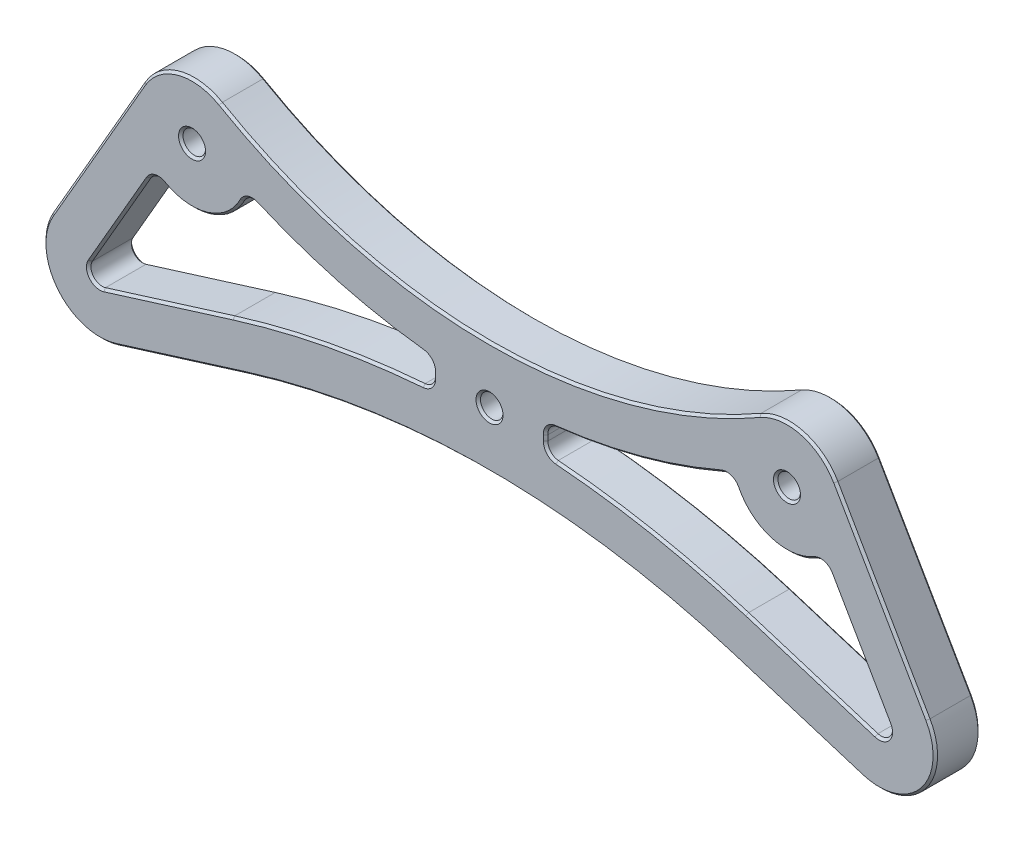
from build123d import *

# Parameters (mm, degrees)
SKETCH1_R           = 2
BOSS_EXTRUDE1_DEPTH = 8
CHAMFER1_SIZE       = 0.4


with BuildPart() as part:
    # Sketch1 → Boss-Extrude1 (new body)
    with BuildSketch(Plane.XY):
        with BuildLine():
            Line((-66.308814514, -129.547773352), (-43.320112037, -122.388992281))
            ThreePointArc((-43.320112037, -122.388992281), (0, -115.8), (43.320112037, -122.388992281))
            Line((43.320112037, -122.388992281), (66.308814514, -129.547773352))
            ThreePointArc((66.308814514, -129.547773352), (77.091963333, -126.245396489), (77.942286341, -115))
            Line((77.942286341, -115), (61.560254038, -86.62548772))
            ThreePointArc((61.560254038, -86.62548772), (55.488190451, -81.966229458), (47.9, -82.965233683))
            ThreePointArc((47.9, -82.965233683), (0, -95.8), (-47.9, -82.965233683))
            ThreePointArc((-47.9, -82.965233683), (-55.488190451, -81.966229458), (-61.560254038, -86.62548772))
            Line((-61.560254038, -86.62548772), (-77.942286341, -115))
            ThreePointArc((-77.942286341, -115), (-77.091963333, -126.245396489), (-66.308814514, -129.547773352))
        make_face()
        with Locations((-52.9, -91.62548772)):
            Circle(SKETCH1_R, mode=Mode.SUBTRACT)
        with Locations((0, -105.8)):
            Circle(SKETCH1_R, mode=Mode.SUBTRACT)
        with Locations((52.9, -91.62548772)):
            Circle(SKETCH1_R, mode=Mode.SUBTRACT)
        with BuildLine():
            Line((-71.01408311, -119), (-60.632050808, -101.017792566))
            ThreePointArc((-60.632050808, -101.017792566), (-59.41763809, -100.085940913), (-57.9, -100.285741758))
            ThreePointArc((-57.9, -100.285741758), (-50.03884881, -101.207440229), (-43.970129475, -96.126311247))
            ThreePointArc((-43.970129475, -96.126311247), (-42.86414468, -95.145621216), (-41.386723322, -95.192327068))
            ThreePointArc((-41.386723322, -95.192327068), (-26.865416882, -100.263100769), (-11.754209758, -103.132335147))
            ThreePointArc((-11.754209758, -103.132335147), (-10.451372404, -103.830597372), (-9.98390649, -105.23289225))
            ThreePointArc((-9.98390649, -105.23289225), (-9.999586121, -105.709019747), (-9.992572367, -106.185353717))
            ThreePointArc((-9.992572367, -106.185353717), (-10.497515805, -107.592554365), (-11.837059844, -108.256484561))
            ThreePointArc((-11.837059844, -108.256484561), (-28.950552114, -110.551129126), (-45.698686268, -114.750773599))
            Line((-45.698686268, -114.750773599), (-68.687388745, -121.90955467))
            ThreePointArc((-68.687388745, -121.90955467), (-70.844018509, -121.249079298), (-71.01408311, -119))
        make_face(mode=Mode.SUBTRACT)
        with BuildLine():
            Line((71.01408311, -119), (60.632050808, -101.017792566))
            ThreePointArc((60.632050808, -101.017792566), (59.41763809, -100.085940913), (57.9, -100.285741758))
            ThreePointArc((57.9, -100.285741758), (50.03884881, -101.207440229), (43.970129475, -96.126311247))
            ThreePointArc((43.970129475, -96.126311247), (42.86414468, -95.145621216), (41.386723322, -95.192327068))
            ThreePointArc((41.386723322, -95.192327068), (26.865416882, -100.263100769), (11.754209758, -103.132335147))
            ThreePointArc((11.754209758, -103.132335147), (10.451372404, -103.830597372), (9.98390649, -105.23289225))
            ThreePointArc((9.98390649, -105.23289225), (9.999586121, -105.709019747), (9.992572367, -106.185353717))
            ThreePointArc((9.992572367, -106.185353717), (10.497515805, -107.592554365), (11.837059844, -108.256484561))
            ThreePointArc((11.837059844, -108.256484561), (28.950552114, -110.551129126), (45.698686268, -114.750773599))
            Line((45.698686268, -114.750773599), (68.687388745, -121.90955467))
            ThreePointArc((68.687388745, -121.90955467), (70.844018509, -121.249079298), (71.01408311, -119))
        make_face(mode=Mode.SUBTRACT)
    extrude(amount=BOSS_EXTRUDE1_DEPTH)

    # Chamfer1
    chamfer1_edges = [part.edges().sort_by_distance(p)[0] for p in [
        (-69.751270189, -100.81274386, 0),
        (-55.488190451, -81.966229458, 0),
        (0, -95.8, 0),
        (55.488190451, -81.966229458, 0),
        (69.751270189, -100.81274386, 0),
        (77.091963333, -126.245396489, 0),
        (54.814463276, -125.968382816, 0),
        (0, -115.8, 8),
        (0, -115.8, 0),
        (-54.814463276, -125.968382816, 0),
        (-77.091963333, -126.245396489, 0),
        (54.814463276, -125.968382816, 8),
        (77.091963333, -126.245396489, 8),
        (69.751270189, -100.81274386, 8),
        (-54.9, -91.62548772, 0),
        (-54.9, -91.62548772, 8),
        (55.488190451, -81.966229458, 8),
        (-2, -105.8, 0),
        (-2, -105.8, 8),
        (0, -95.8, 8),
        (50.9, -91.62548772, 0),
        (50.9, -91.62548772, 8),
        (-55.488190451, -81.966229458, 8),
        (-69.751270189, -100.81274386, 8),
        (-70.844018509, -121.249079298, 0),
        (-57.193037507, -118.330164135, 0),
        (-28.950552114, -110.551129126, 0),
        (-10.497515805, -107.592554365, 0),
        (-9.999586121, -105.709019747, 0),
        (-10.451372404, -103.830597372, 0),
        (-26.865416882, -100.263100769, 0),
        (-42.86414468, -95.145621216, 0),
        (-50.03884881, -101.207440229, 0),
        (-59.41763809, -100.085940913, 0),
        (-77.091963333, -126.245396489, 8),
        (-65.823066959, -110.008896283, 0),
        (-70.844018509, -121.249079298, 8),
        (-57.193037507, -118.330164135, 8),
        (-28.950552114, -110.551129126, 8),
        (-10.497515805, -107.592554365, 8),
        (-9.999586121, -105.709019747, 8),
        (-10.451372404, -103.830597372, 8),
        (-26.865416882, -100.263100769, 8),
        (-42.86414468, -95.145621216, 8),
        (-50.03884881, -101.207440229, 8),
        (-59.41763809, -100.085940913, 8),
        (-65.823066959, -110.008896283, 8),
        (28.950552114, -110.551129126, 0),
        (57.193037507, -118.330164135, 0),
        (70.844018509, -121.249079298, 0),
        (65.823066959, -110.008896283, 0),
        (59.41763809, -100.085940913, 0),
        (50.03884881, -101.207440229, 0),
        (42.86414468, -95.145621216, 0),
        (26.865416882, -100.263100769, 0),
        (10.451372404, -103.830597372, 0),
        (9.999586121, -105.709019747, 0),
        (10.497515805, -107.592554365, 0),
        (28.950552114, -110.551129126, 8),
        (57.193037507, -118.330164135, 8),
        (70.844018509, -121.249079298, 8),
        (65.823066959, -110.008896283, 8),
        (59.41763809, -100.085940913, 8),
        (50.03884881, -101.207440229, 8),
        (42.86414468, -95.145621216, 8),
        (26.865416882, -100.263100769, 8),
        (10.451372404, -103.830597372, 8),
        (9.999586121, -105.709019747, 8),
        (10.497515805, -107.592554365, 8),
        (-54.814463276, -125.968382816, 8),
    ]]
    chamfer(chamfer1_edges, length=CHAMFER1_SIZE)


solid = part.part
